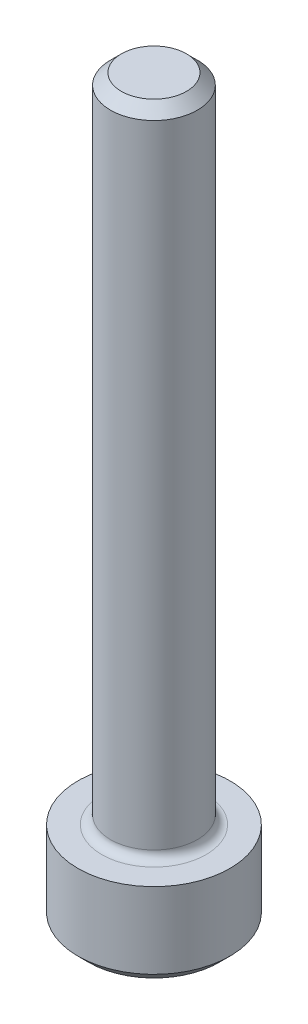
from build123d import *

# Parameters (mm, degrees)
SKETCH2_R           = 2
BOSS_EXTRUDE1_DEPTH = 30
SKETCH3_R           = 3.5
BOSS_EXTRUDE2_DEPTH = 4
FILLET1_R           = 0.4
CHAMFER1_SIZE       = 0.5
CUT_EXTRUDE1_DEPTH  = 2.5


with BuildPart() as part:
    # Sketch2 → Boss-Extrude1 (new body)
    with BuildSketch(Plane(origin=(0, 0, 0), x_dir=(1, 0, 0), z_dir=(0, 1, 0))):
        with Locations(Location((0, 0, 0), (0, 0, 270))):
            Circle(SKETCH2_R)
    extrude(amount=BOSS_EXTRUDE1_DEPTH)

    # Sketch3 → Boss-Extrude2 (add)
    with BuildSketch(Plane(origin=(0, 0, 0), x_dir=(1, 0, 0), z_dir=(0, 1, 0))):
        with Locations(Location((0, 0, 0), (0, 0, 270))):
            Circle(SKETCH3_R)
    extrude(amount=-BOSS_EXTRUDE2_DEPTH)

    # Fillet1
    fillet1_edges = [part.edges().sort_by_distance(p)[0] for p in [
        (0, 0, -2),
    ]]
    fillet(fillet1_edges, radius=FILLET1_R)

    # Chamfer1
    chamfer1_edges = [part.edges().sort_by_distance(p)[0] for p in [
        (0, 30, -2),
        (0, -4, -3.5),
    ]]
    chamfer(chamfer1_edges, length=CHAMFER1_SIZE)

    # Sketch4 → Cut-Extrude1 (cut)
    with BuildSketch(Plane.XZ.offset(4)):
        Polygon((0, 1.732050808), (-1.5, 0.866025404), (-1.5, -0.866025404), (0, -1.732050808), (1.5, -0.866025404), (1.5, 0.866025404), align=None)
    extrude(amount=-CUT_EXTRUDE1_DEPTH, mode=Mode.SUBTRACT)


solid = part.part
